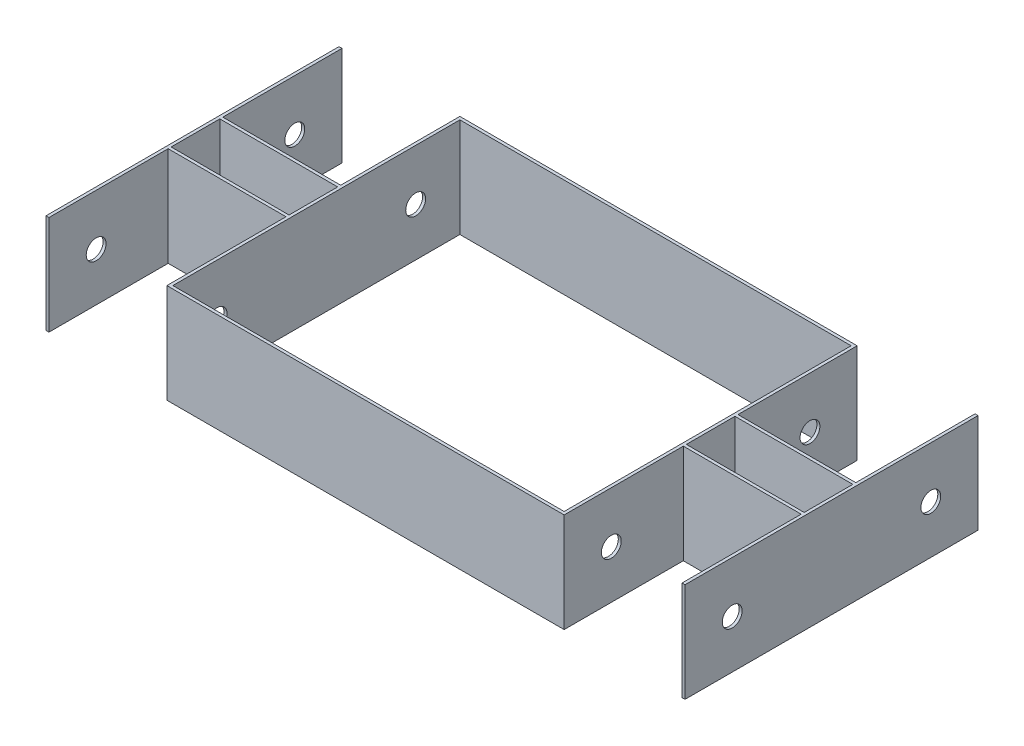
from build123d import *

# Parameters (mm, degrees)
SKETCH1_W               = 118.7
SKETCH1_H               = 49
SKETCH1_W_2             = 394
SKETCH1_H_2             = 289
BOSS_EXTRUDE1_DEPTH     = 100
CUT_EXTRUDE1_DEPTH      = 668.622505612
CUT_EXTRUDE1_DEPTH_BACK = 668.622505612
SKETCH3_R               = 10


with BuildPart() as part:
    # Sketch1 → Boss-Extrude1 (new body)
    with BuildSketch(Plane(origin=(0, 0, 0), x_dir=(1, 0, 0), z_dir=(0, 1, 0))):
        Polygon((200, 147.5), (-200, 147.5), (-200, 27.5), (-318.7, 27.5), (-318.7, 147.5), (-321.7, 147.5), (-321.7, -147.5), (-318.7, -147.5), (-318.7, -27.5), (-200, -27.5), (-200, -147.5), (200, -147.5), (200, -27.5), (318.7, -27.5), (318.7, -147.5), (321.7, -147.5), (321.7, 147.5), (318.7, 147.5), (318.7, 27.5), (200, 27.5), align=None)
        with Locations((259.35, 0)):
            Rectangle(SKETCH1_W, SKETCH1_H, mode=Mode.SUBTRACT)
        with Locations((-259.35, 0)):
            Rectangle(SKETCH1_W, SKETCH1_H, mode=Mode.SUBTRACT)
        Rectangle(SKETCH1_W_2, SKETCH1_H_2, mode=Mode.SUBTRACT)
    extrude(amount=BOSS_EXTRUDE1_DEPTH)

    # Sketch3 → Cut-Extrude1 (cut, two sides: drawn at the far end of the back side and taken through both)
    with BuildSketch(Plane(origin=(321.7, 0, 0), x_dir=(0, 0, -1), z_dir=(1, 0, 0)).offset(-CUT_EXTRUDE1_DEPTH_BACK)):
        with Locations(Location((-100, 48.5, 0), (0, 0, 180))):
            Circle(SKETCH3_R)
        with Locations(Location((100, 48.5, 0), (0, 0, 180))):
            Circle(SKETCH3_R)
    extrude(amount=CUT_EXTRUDE1_DEPTH + CUT_EXTRUDE1_DEPTH_BACK, mode=Mode.SUBTRACT)


solid = part.part
